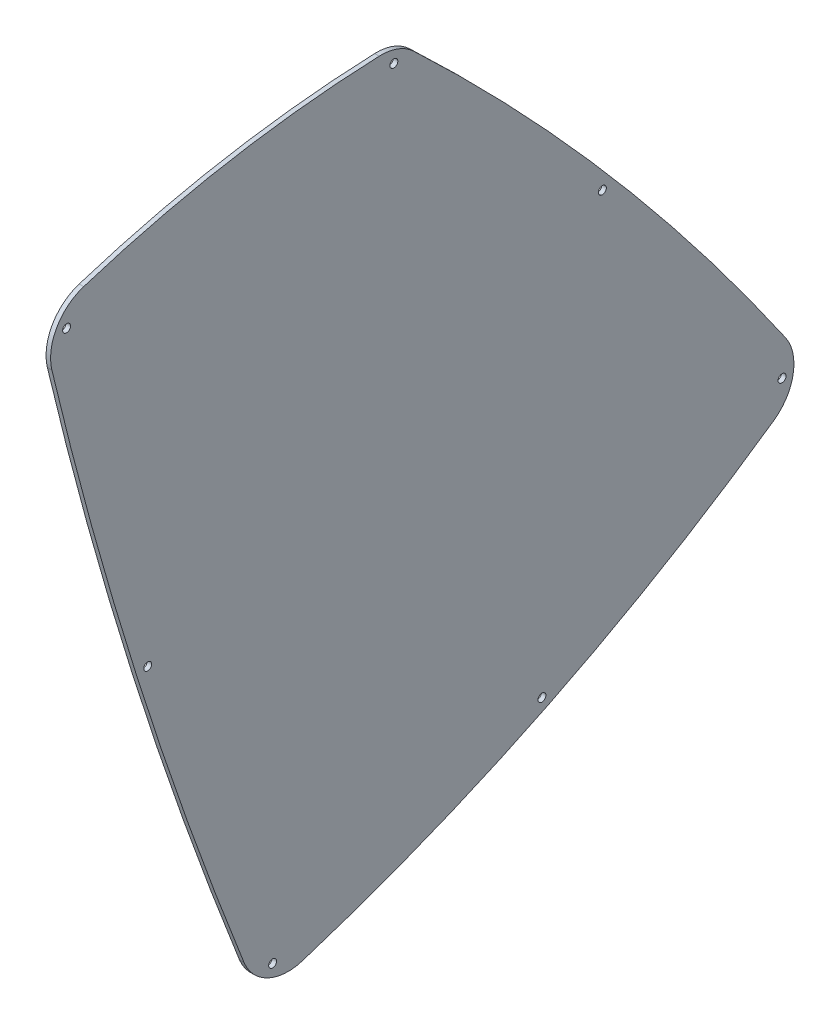
from build123d import *

# Parameters (mm, degrees)
CROQUIS2_R              = 1.75
SALIENTE_EXTRUIR1_DEPTH = 2


with BuildPart() as part:
    # Croquis2 → Saliente-Extruir1 (new body)
    with BuildSketch(Plane(origin=(0, 0, 0), x_dir=(0, 0, -1), z_dir=(1, 0, 0))):
        with BuildLine():
            ThreePointArc((-1624.025321873, 121.730654261), (-1586.485988342, -14.209738678), (-1539.232552396, -147.086014911))
            ThreePointArc((-1539.232552396, -147.086014911), (-1528.736264964, -158.30256709), (-1513.411789801, -159.371937759))
            ThreePointArc((-1513.411789801, -159.371937759), (-1405.508639065, -116.120173058), (-1305.452205903, -56.938121124))
            ThreePointArc((-1305.452205903, -56.938121124), (-1296.824738042, -43.452916514), (-1300.208231124, -27.805682905))
            ThreePointArc((-1300.208231124, -27.805682905), (-1377.246544078, 72.245539551), (-1464.284458168, 163.730785841))
            ThreePointArc((-1464.284458168, 163.730785841), (-1471.327397008, 168.136856279), (-1479.527832165, 169.467009446))
            ThreePointArc((-1479.527832165, 169.467009446), (-1545.52768268, 162.44811464), (-1609.97790425, 146.592071884))
            ThreePointArc((-1609.97790425, 146.592071884), (-1621.877582945, 136.916426614), (-1624.025321873, 121.730654261))
        make_face()
        with Locations((-1581.717582688, -12.705641768)):
            Circle(CROQUIS2_R, mode=Mode.SUBTRACT)
        with Locations((-1526.587976686, -153.787607791)):
            Circle(CROQUIS2_R, mode=Mode.SUBTRACT)
        with Locations((-1617.52441717, 134.456762464)):
            Circle(CROQUIS2_R, mode=Mode.SUBTRACT)
        with Locations((-1407.717991662, -111.634778861)):
            Circle(CROQUIS2_R, mode=Mode.SUBTRACT)
        with Locations((-1301.74565066, -42.567129287)):
            Circle(CROQUIS2_R, mode=Mode.SUBTRACT)
        with Locations((-1381.043785842, 68.992701562)):
            Circle(CROQUIS2_R, mode=Mode.SUBTRACT)
        with Locations((-1473.088384765, 163.457227863)):
            Circle(CROQUIS2_R, mode=Mode.SUBTRACT)
    extrude(amount=SALIENTE_EXTRUIR1_DEPTH)


solid = part.part
